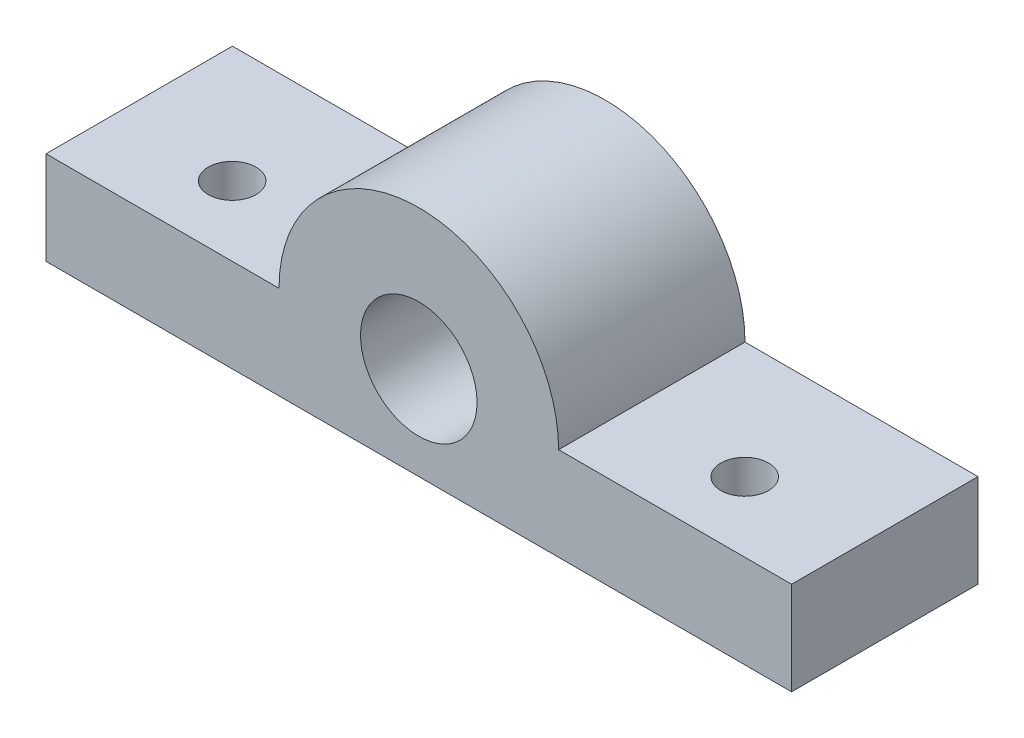
from build123d import *

# Parameters (mm, degrees)
CROQUIS1_R                                     = 2.5
SALIENTE_EXTRUIR1_DEPTH                        = 8
PERFORADOR_PARA_ROSCAR_PARA_MACHO_DE_ROS_D     = 2.05
PERFORADOR_PARA_ROSCAR_PARA_MACHO_DE_ROS_DEPTH = 10
PERFORADOR_PARA_ROSCAR_PARA_MACHO_DE_ROS_TIP   = 0.615882135


with BuildPart() as part:
    # Croquis1 → Saliente-Extruir1 (new body)
    with BuildSketch(Plane.XY):
        with BuildLine():
            Line((-51.94164691, 0), (-19.94164691, 0))
            Line((-19.94164691, 0), (-19.94164691, 4))
            Line((-19.94164691, 4), (-29.94164691, 4))
            ThreePointArc((-29.94164691, 4), (-35.94164691, 10), (-41.94164691, 4))
            Line((-41.94164691, 4), (-51.94164691, 4))
            Line((-51.94164691, 4), (-51.94164691, 0))
        make_face()
        with Locations((-35.94164691, 4)):
            Circle(CROQUIS1_R, mode=Mode.SUBTRACT)
    extrude(amount=SALIENTE_EXTRUIR1_DEPTH)

    # Perforador para roscar para macho de roscar para M2.5x0.451
    with Locations(Plane(origin=(0, 4, 0), x_dir=(1, 0, 0), z_dir=(0, 1, 0))):
        with Locations((-46.940104762, -5.012552849), (-24.941517603, -5.012552849)):
            Hole(PERFORADOR_PARA_ROSCAR_PARA_MACHO_DE_ROS_D / 2, depth=PERFORADOR_PARA_ROSCAR_PARA_MACHO_DE_ROS_DEPTH)
            with Locations((0, 0, -(PERFORADOR_PARA_ROSCAR_PARA_MACHO_DE_ROS_DEPTH + PERFORADOR_PARA_ROSCAR_PARA_MACHO_DE_ROS_TIP / 2))):  # 118° drill point
                Cone(0, PERFORADOR_PARA_ROSCAR_PARA_MACHO_DE_ROS_D / 2, PERFORADOR_PARA_ROSCAR_PARA_MACHO_DE_ROS_TIP, mode=Mode.SUBTRACT)


solid = part.part
